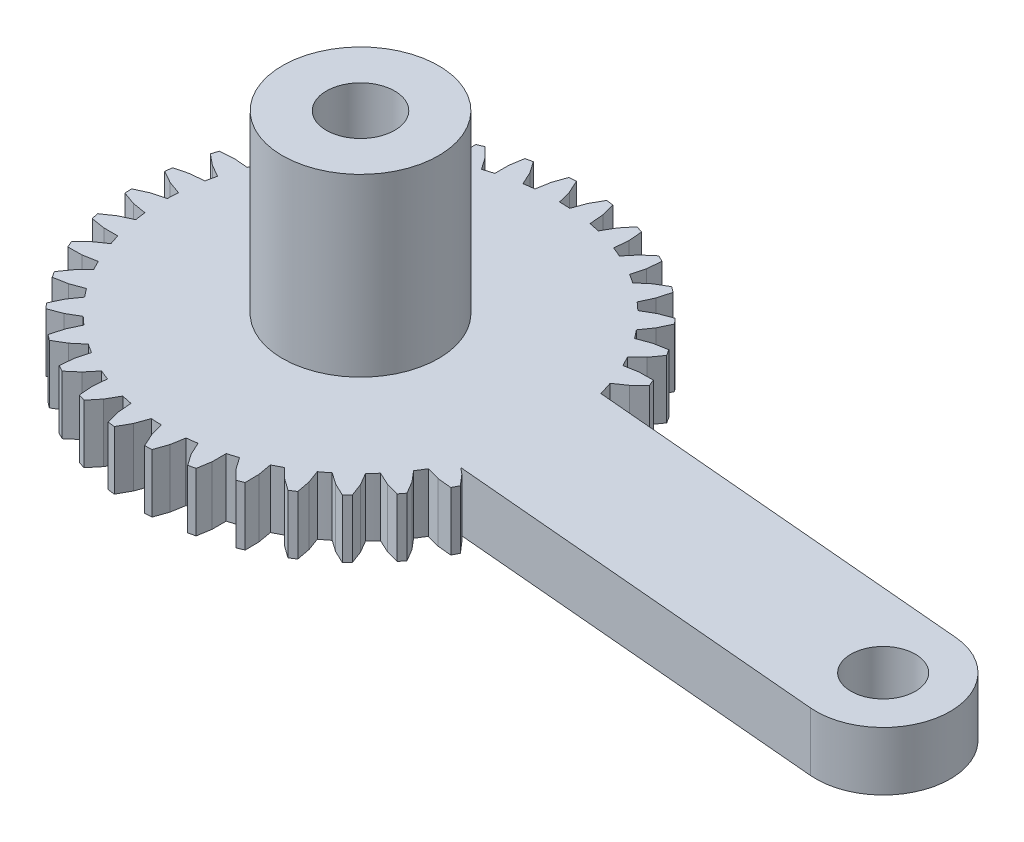
from build123d import *

# Parameters (mm, degrees)
SKETCH_1_R      = 1.75
SKETCH_1_R_2    = 1.65
EXTRUDE_1_DEPTH = 3
SKETCH_3_R      = 4
SKETCH_3_R_2    = 1.75
EXTRUDE_2_DEPTH = 9


with BuildPart() as part:
    # 草图1 → 凸台-拉伸1 (new body)
    with BuildSketch(Plane(origin=(0, 0, 0), x_dir=(1, 0, 0), z_dir=(0, 1, 0))):
        with BuildLine():
            Line((4.082652453, 9.182284571), (4.542193627, 9.733960118))
            Line((4.542193627, 9.733960118), (5.08677931, 10.201881516))
            Line((5.08677931, 10.201881516), (5.409142478, 10.034684243))
            Line((5.409142478, 10.034684243), (5.340349944, 9.319987393))
            Line((5.340349944, 9.319987393), (5.154106126, 8.626563107))
            ThreePointArc((5.154106126, 8.626563107), (5.386599243, 8.483333637), (5.615114771, 8.333839878))
            Line((5.615114771, 8.333839878), (6.163471936, 8.797335746))
            Line((6.163471936, 8.797335746), (6.781037836, 9.163582055))
            Line((6.781037836, 9.163582055), (7.069470082, 8.942947108))
            Line((7.069470082, 8.942947108), (6.877616855, 8.251053807))
            Line((6.877616855, 8.251053807), (6.573790635, 7.600505094))
            ThreePointArc((6.573790635, 7.600505094), (6.777880123, 7.419079595), (6.976964668, 7.232175677))
            Line((6.976964668, 7.232175677), (7.597476268, 7.593408779))
            Line((7.597476268, 7.593408779), (8.269257959, 7.84685179))
            Line((8.269257959, 7.84685179), (8.514995414, 7.57948305))
            Line((8.514995414, 7.57948305), (8.205910859, 6.931416126))
            Line((8.205910859, 6.931416126), (7.793733843, 6.343509579))
            ThreePointArc((7.793733843, 6.343509579), (7.963218546, 6.129400573), (8.126823025, 5.910765477))
            Line((8.126823025, 5.910765477), (8.800635129, 6.158759929))
            Line((8.800635129, 6.158759929), (9.506220864, 6.291698904))
            Line((9.506220864, 6.291698904), (9.70179692, 5.985720234))
            Line((9.70179692, 5.985720234), (9.284872413, 5.401170874))
            Line((9.284872413, 5.401170874), (8.776868392, 4.893769736))
            ThreePointArc((8.776868392, 4.893769736), (8.906598603, 4.653482817), (9.029751976, 4.40975966))
            Line((9.029751976, 4.40975966), (9.736391145, 4.536980274))
            Line((9.736391145, 4.536980274), (10.454342057, 4.545375931))
            Line((10.454342057, 4.545375931), (10.593814236, 4.210084339))
            Line((10.593814236, 4.210084339), (10.081717818, 3.706813777))
            Line((10.081717818, 3.706813777), (9.493322236, 3.295335175))
            ThreePointArc((9.493322236, 3.295335175), (9.605486672, 2.952461141), (9.70527181, 2.605782052))
            Line((9.70527181, 2.605782052), (29.630044927, 0.872745351))
            ThreePointArc((29.630044927, 0.872745351), (32.75625883, -2.849106406), (29.034407073, -5.975320308))
            Line((29.034407073, -5.975320308), (9.404734164, -4.267951126))
            Line((9.404734164, -4.267951126), (9.733960118, -4.542193627))
            Line((9.733960118, -4.542193627), (10.201881516, -5.08677931))
            Line((10.201881516, -5.08677931), (10.034684243, -5.409142478))
            Line((10.034684243, -5.409142478), (9.319987393, -5.340349944))
            Line((9.319987393, -5.340349944), (8.626563107, -5.154106126))
            ThreePointArc((8.626563107, -5.154106126), (8.483333637, -5.386599243), (8.333839878, -5.615114771))
            Line((8.333839878, -5.615114771), (8.797335746, -6.163471936))
            Line((8.797335746, -6.163471936), (9.163582055, -6.781037836))
            Line((9.163582055, -6.781037836), (8.942947108, -7.069470082))
            Line((8.942947108, -7.069470082), (8.251053807, -6.877616855))
            Line((8.251053807, -6.877616855), (7.600505094, -6.573790635))
            ThreePointArc((7.600505094, -6.573790635), (7.419079595, -6.777880123), (7.232175677, -6.976964668))
            Line((7.232175677, -6.976964668), (7.593408779, -7.597476268))
            Line((7.593408779, -7.597476268), (7.84685179, -8.269257959))
            Line((7.84685179, -8.269257959), (7.57948305, -8.514995414))
            Line((7.57948305, -8.514995414), (6.931416126, -8.205910859))
            Line((6.931416126, -8.205910859), (6.343509579, -7.793733843))
            ThreePointArc((6.343509579, -7.793733843), (6.129400573, -7.963218546), (5.910765477, -8.126823025))
            Line((5.910765477, -8.126823025), (6.158759929, -8.800635129))
            Line((6.158759929, -8.800635129), (6.291698904, -9.506220864))
            Line((6.291698904, -9.506220864), (5.985720234, -9.70179692))
            Line((5.985720234, -9.70179692), (5.401170874, -9.284872413))
            Line((5.401170874, -9.284872413), (4.893769736, -8.776868392))
            ThreePointArc((4.893769736, -8.776868392), (4.653482817, -8.906598603), (4.40975966, -9.029751976))
            Line((4.40975966, -9.029751976), (4.536980274, -9.736391145))
            Line((4.536980274, -9.736391145), (4.545375931, -10.454342057))
            Line((4.545375931, -10.454342057), (4.210084339, -10.593814236))
            Line((4.210084339, -10.593814236), (3.706813777, -10.081717818))
            Line((3.706813777, -10.081717818), (3.295335175, -9.493322236))
            ThreePointArc((3.295335175, -9.493322236), (3.03617134, -9.579356168), (2.774765527, -9.658316482))
            Line((2.774765527, -9.658316482), (2.77734677, -10.376311842))
            Line((2.77734677, -10.376311842), (2.66094401, -11.084813358))
            Line((2.66094401, -11.084813358), (2.306527161, -11.163943867))
            Line((2.306527161, -11.163943867), (1.89982702, -10.572235328))
            Line((1.89982702, -10.572235328), (1.596773523, -9.921326288))
            ThreePointArc((1.596773523, -9.921326288), (1.326607334, -9.961049843), (1.055461547, -9.99341793))
            Line((1.055461547, -9.99341793), (0.933324989, -10.700953555))
            Line((0.933324989, -10.700953555), (0.695660652, -11.378478214))
            Line((0.695660652, -11.378478214), (0.332887323, -11.394862713))
            Line((0.332887323, -11.394862713), (0.03511498, -10.741520817))
            Line((0.03511498, -10.741520817), (-0.150305285, -10.047875861))
            ThreePointArc((-0.150305285, -10.047875861), (-0.423264966, -10.04008206), (-0.695912098, -10.024874431))
            Line((-0.695912098, -10.024874431), (-0.939055399, -10.70045221))
            Line((-0.939055399, -10.70045221), (-1.290760003, -11.326413767))
            Line((-1.290760003, -11.326413767), (-1.650867128, -11.279554421))
            Line((-1.650867128, -11.279554421), (-1.83066401, -10.584430632))
            Line((-1.83066401, -10.584430632), (-1.892817143, -9.869125811))
            ThreePointArc((-1.892817143, -9.869125811), (-2.160276573, -9.814051463), (-2.426140806, -9.751730195))
            Line((-2.426140806, -9.751730195), (-2.782903063, -10.374823038))
            Line((-2.782903063, -10.374823038), (-3.237961568, -10.930201969))
            Line((-3.237961568, -10.930201969), (-3.584460817, -10.821522576))
            Line((-3.584460817, -10.821522576), (-3.640819202, -10.105737879))
            Line((-3.640819202, -10.105737879), (-3.577816709, -9.390507366))
            ThreePointArc((-3.577816709, -9.390507366), (-3.83164927, -9.28982588), (-4.082652453, -9.182284571))
            Line((-4.082652453, -9.182284571), (-4.542193627, -9.733960118))
            Line((-4.542193627, -9.733960118), (-5.08677931, -10.201881516))
            Line((-5.08677931, -10.201881516), (-5.409142478, -10.034684243))
            Line((-5.409142478, -10.034684243), (-5.340349944, -9.319987393))
            Line((-5.340349944, -9.319987393), (-5.154106126, -8.626563107))
            ThreePointArc((-5.154106126, -8.626563107), (-5.386599243, -8.483333637), (-5.615114771, -8.333839878))
            Line((-5.615114771, -8.333839878), (-6.163471936, -8.797335746))
            Line((-6.163471936, -8.797335746), (-6.781037836, -9.163582055))
            Line((-6.781037836, -9.163582055), (-7.069470082, -8.942947108))
            Line((-7.069470082, -8.942947108), (-6.877616855, -8.251053807))
            Line((-6.877616855, -8.251053807), (-6.573790635, -7.600505094))
            ThreePointArc((-6.573790635, -7.600505094), (-6.777880123, -7.419079595), (-6.976964668, -7.232175677))
            Line((-6.976964668, -7.232175677), (-7.597476268, -7.593408779))
            Line((-7.597476268, -7.593408779), (-8.269257959, -7.84685179))
            Line((-8.269257959, -7.84685179), (-8.514995414, -7.57948305))
            Line((-8.514995414, -7.57948305), (-8.205910859, -6.931416126))
            Line((-8.205910859, -6.931416126), (-7.793733843, -6.343509579))
            ThreePointArc((-7.793733843, -6.343509579), (-7.963218546, -6.129400573), (-8.126823025, -5.910765477))
            Line((-8.126823025, -5.910765477), (-8.800635129, -6.158759929))
            Line((-8.800635129, -6.158759929), (-9.506220864, -6.291698904))
            Line((-9.506220864, -6.291698904), (-9.70179692, -5.985720234))
            Line((-9.70179692, -5.985720234), (-9.284872413, -5.401170874))
            Line((-9.284872413, -5.401170874), (-8.776868392, -4.893769736))
            ThreePointArc((-8.776868392, -4.893769736), (-8.906598603, -4.653482817), (-9.029751976, -4.40975966))
            Line((-9.029751976, -4.40975966), (-9.736391145, -4.536980274))
            Line((-9.736391145, -4.536980274), (-10.454342057, -4.545375931))
            Line((-10.454342057, -4.545375931), (-10.593814236, -4.210084339))
            Line((-10.593814236, -4.210084339), (-10.081717818, -3.706813777))
            Line((-10.081717818, -3.706813777), (-9.493322236, -3.295335175))
            ThreePointArc((-9.493322236, -3.295335175), (-9.579356168, -3.03617134), (-9.658316482, -2.774765527))
            Line((-9.658316482, -2.774765527), (-10.376311842, -2.77734677))
            Line((-10.376311842, -2.77734677), (-11.084813358, -2.66094401))
            Line((-11.084813358, -2.66094401), (-11.163943867, -2.306527161))
            Line((-11.163943867, -2.306527161), (-10.572235328, -1.89982702))
            Line((-10.572235328, -1.89982702), (-9.921326288, -1.596773523))
            ThreePointArc((-9.921326288, -1.596773523), (-9.961049843, -1.326607334), (-9.99341793, -1.055461547))
            Line((-9.99341793, -1.055461547), (-10.700953555, -0.933324989))
            Line((-10.700953555, -0.933324989), (-11.378478214, -0.695660652))
            Line((-11.378478214, -0.695660652), (-11.394862713, -0.332887323))
            Line((-11.394862713, -0.332887323), (-10.741520817, -0.03511498))
            Line((-10.741520817, -0.03511498), (-10.047875861, 0.150305285))
            ThreePointArc((-10.047875861, 0.150305285), (-10.04008206, 0.423264966), (-10.024874431, 0.695912098))
            Line((-10.024874431, 0.695912098), (-10.70045221, 0.939055399))
            Line((-10.70045221, 0.939055399), (-11.326413767, 1.290760003))
            Line((-11.326413767, 1.290760003), (-11.279554421, 1.650867128))
            Line((-11.279554421, 1.650867128), (-10.584430632, 1.83066401))
            Line((-10.584430632, 1.83066401), (-9.869125811, 1.892817143))
            ThreePointArc((-9.869125811, 1.892817143), (-9.814051463, 2.160276573), (-9.751730195, 2.426140806))
            Line((-9.751730195, 2.426140806), (-10.374823038, 2.782903063))
            Line((-10.374823038, 2.782903063), (-10.930201969, 3.237961568))
            Line((-10.930201969, 3.237961568), (-10.821522576, 3.584460817))
            Line((-10.821522576, 3.584460817), (-10.105737879, 3.640819202))
            Line((-10.105737879, 3.640819202), (-9.390507366, 3.577816709))
            ThreePointArc((-9.390507366, 3.577816709), (-9.28982588, 3.83164927), (-9.182284571, 4.082652453))
            Line((-9.182284571, 4.082652453), (-9.733960118, 4.542193627))
            Line((-9.733960118, 4.542193627), (-10.201881516, 5.08677931))
            Line((-10.201881516, 5.08677931), (-10.034684243, 5.409142478))
            Line((-10.034684243, 5.409142478), (-9.319987393, 5.340349944))
            Line((-9.319987393, 5.340349944), (-8.626563107, 5.154106126))
            ThreePointArc((-8.626563107, 5.154106126), (-8.483333637, 5.386599243), (-8.333839878, 5.615114771))
            Line((-8.333839878, 5.615114771), (-8.797335746, 6.163471936))
            Line((-8.797335746, 6.163471936), (-9.163582055, 6.781037836))
            Line((-9.163582055, 6.781037836), (-8.942947108, 7.069470082))
            Line((-8.942947108, 7.069470082), (-8.251053807, 6.877616855))
            Line((-8.251053807, 6.877616855), (-7.600505094, 6.573790635))
            ThreePointArc((-7.600505094, 6.573790635), (-7.419079595, 6.777880123), (-7.232175677, 6.976964668))
            Line((-7.232175677, 6.976964668), (-7.593408779, 7.597476268))
            Line((-7.593408779, 7.597476268), (-7.84685179, 8.269257959))
            Line((-7.84685179, 8.269257959), (-7.57948305, 8.514995414))
            Line((-7.57948305, 8.514995414), (-6.931416126, 8.205910859))
            Line((-6.931416126, 8.205910859), (-6.343509579, 7.793733843))
            ThreePointArc((-6.343509579, 7.793733843), (-6.129400573, 7.963218546), (-5.910765477, 8.126823025))
            Line((-5.910765477, 8.126823025), (-6.158759929, 8.800635129))
            Line((-6.158759929, 8.800635129), (-6.291698904, 9.506220864))
            Line((-6.291698904, 9.506220864), (-5.985720234, 9.70179692))
            Line((-5.985720234, 9.70179692), (-5.401170874, 9.284872413))
            Line((-5.401170874, 9.284872413), (-4.893769736, 8.776868392))
            ThreePointArc((-4.893769736, 8.776868392), (-4.653482817, 8.906598603), (-4.40975966, 9.029751976))
            Line((-4.40975966, 9.029751976), (-4.536980274, 9.736391145))
            Line((-4.536980274, 9.736391145), (-4.545375931, 10.454342057))
            Line((-4.545375931, 10.454342057), (-4.210084339, 10.593814236))
            Line((-4.210084339, 10.593814236), (-3.706813777, 10.081717818))
            Line((-3.706813777, 10.081717818), (-3.295335175, 9.493322236))
            ThreePointArc((-3.295335175, 9.493322236), (-3.03617134, 9.579356168), (-2.774765527, 9.658316482))
            Line((-2.774765527, 9.658316482), (-2.77734677, 10.376311842))
            Line((-2.77734677, 10.376311842), (-2.66094401, 11.084813358))
            Line((-2.66094401, 11.084813358), (-2.306527161, 11.163943867))
            Line((-2.306527161, 11.163943867), (-1.89982702, 10.572235328))
            Line((-1.89982702, 10.572235328), (-1.596773523, 9.921326288))
            ThreePointArc((-1.596773523, 9.921326288), (-1.326607334, 9.961049843), (-1.055461547, 9.99341793))
            Line((-1.055461547, 9.99341793), (-0.933324989, 10.700953555))
            Line((-0.933324989, 10.700953555), (-0.695660652, 11.378478214))
            Line((-0.695660652, 11.378478214), (-0.332887323, 11.394862713))
            Line((-0.332887323, 11.394862713), (-0.03511498, 10.741520817))
            Line((-0.03511498, 10.741520817), (0.150305285, 10.047875861))
            ThreePointArc((0.150305285, 10.047875861), (0.423264966, 10.04008206), (0.695912098, 10.024874431))
            Line((0.695912098, 10.024874431), (0.939055399, 10.70045221))
            Line((0.939055399, 10.70045221), (1.290760003, 11.326413767))
            Line((1.290760003, 11.326413767), (1.650867128, 11.279554421))
            Line((1.650867128, 11.279554421), (1.83066401, 10.584430632))
            Line((1.83066401, 10.584430632), (1.892817143, 9.869125811))
            ThreePointArc((1.892817143, 9.869125811), (2.160276573, 9.814051463), (2.426140806, 9.751730195))
            Line((2.426140806, 9.751730195), (2.782903063, 10.374823038))
            Line((2.782903063, 10.374823038), (3.237961568, 10.930201969))
            Line((3.237961568, 10.930201969), (3.584460817, 10.821522576))
            Line((3.584460817, 10.821522576), (3.640819202, 10.105737879))
            Line((3.640819202, 10.105737879), (3.577816709, 9.390507366))
            ThreePointArc((3.577816709, 9.390507366), (3.83164927, 9.28982588), (4.082652453, 9.182284571))
        make_face()
        with Locations(Location((0, 0, 0), (0, 0, 270))):
            Circle(SKETCH_1_R, mode=Mode.SUBTRACT)
        with Locations(Location((29.332226, -2.551287478, 0), (0, 0, 270))):
            Circle(SKETCH_1_R_2, mode=Mode.SUBTRACT)
    extrude(amount=EXTRUDE_1_DEPTH)

    # 草图3 → 凸台-拉伸2 (add)
    with BuildSketch(Plane(origin=(0, 3, 0), x_dir=(1, 0, 0), z_dir=(0, 1, 0))):
        with Locations(Location((0, 0, 0), (0, 0, 270))):
            Circle(SKETCH_3_R)
        with Locations(Location((0, 0, 0), (0, 0, 270))):
            Circle(SKETCH_3_R_2, mode=Mode.SUBTRACT)
    extrude(amount=EXTRUDE_2_DEPTH)


solid = part.part
